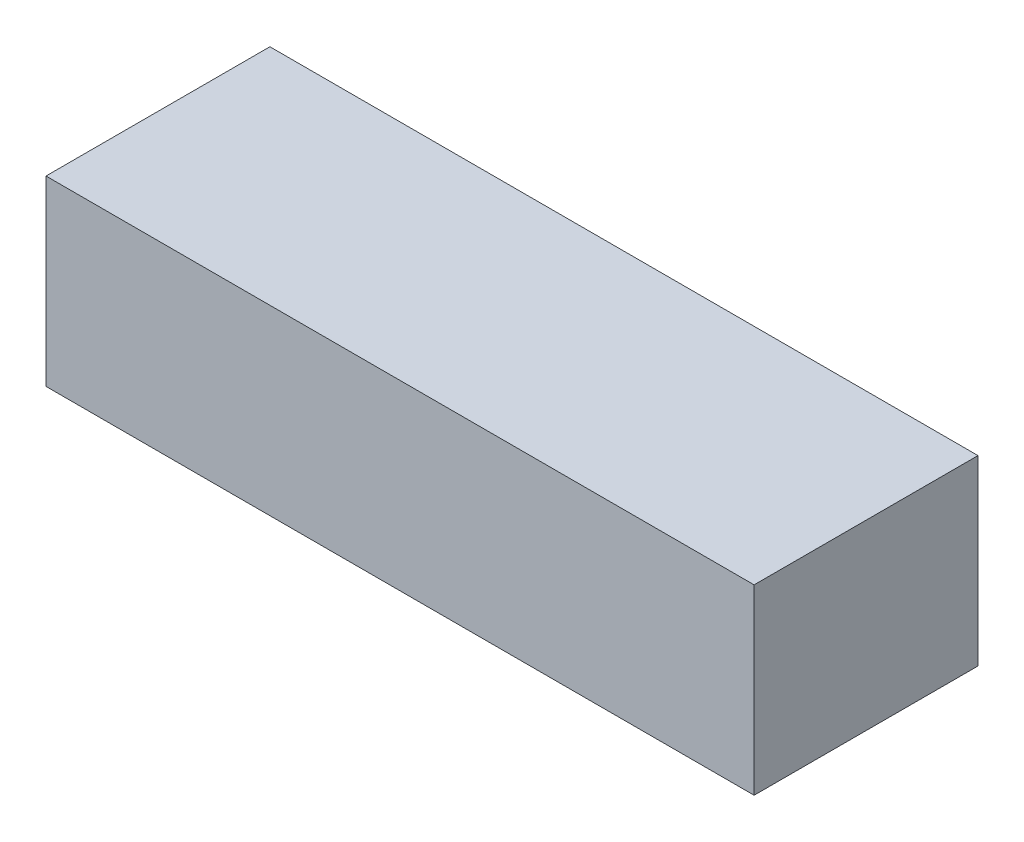
from build123d import *

# Parameters (mm, degrees)
SKETCH1_W           = 136
SKETCH1_H           = 43
BOSS_EXTRUDE1_DEPTH = 35


with BuildPart() as part:
    # Sketch1 → Boss-Extrude1 (new body)
    with BuildSketch(Plane(origin=(0, 0, 0), x_dir=(1, 0, 0), z_dir=(0, 1, 0))):
        Rectangle(SKETCH1_W, SKETCH1_H)
    extrude(amount=BOSS_EXTRUDE1_DEPTH)


solid = part.part
